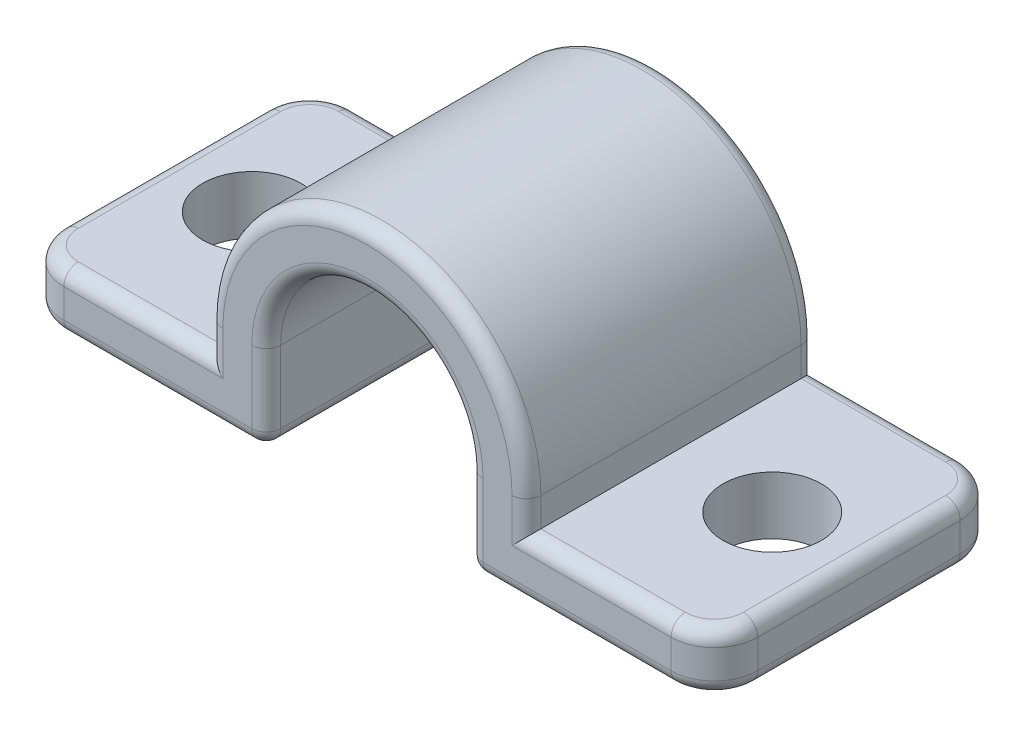
from build123d import *

# Parameters (mm, degrees)
BOSS_EXTRUDE1_DEPTH  = 10
M3_CLEARANCE_HOLE1_D = 3.4
FILLET1_R            = 1.5
FILLET2_R            = 0.5


with BuildPart() as part:
    # Sketch1 → Boss-Extrude1 (new body)
    with BuildSketch(Plane.XY):
        with BuildLine():
            ThreePointArc((-5.5, 0), (-5.477033779, -0.502096593), (-5.408326913, -1))
            Line((-5.408326913, -1), (-3.5, -1))
            Line((-3.5, -1), (-3.5, 0))
            ThreePointArc((-3.5, 0), (0, 3.5), (3.5, 0))
            Line((3.5, 0), (3.5, -1))
            Line((3.5, -1), (5.408326913, -1))
            ThreePointArc((5.408326913, -1), (5.477033779, -0.502096593), (5.5, 0))
            ThreePointArc((5.5, 0), (0, 5.5), (-5.5, 0))
        make_face()
        with BuildLine():
            Line((5.5, -1), (5.5, 0))
            ThreePointArc((5.5, 0), (5.477033779, -0.502096593), (5.408326913, -1))
            Line((5.408326913, -1), (5.5, -1))
        make_face()
        with BuildLine():
            Line((-5.5, 0), (-5.5, -1))
            Line((-5.5, -1), (-5.408326913, -1))
            ThreePointArc((-5.408326913, -1), (-5.477033779, -0.502096593), (-5.5, 0))
        make_face()
        with BuildLine():
            Line((-5.5, -1), (-12, -1))
            Line((-12, -1), (-12, -3))
            Line((-12, -3), (-4.609772229, -3))
            ThreePointArc((-4.609772229, -3), (-5.107893656, -2.039466204), (-5.408326913, -1))
            Line((-5.408326913, -1), (-5.5, -1))
        make_face()
        with BuildLine():
            Line((-3.5, -1), (-5.408326913, -1))
            ThreePointArc((-5.408326913, -1), (-5.107893656, -2.039466204), (-4.609772229, -3))
            Line((-4.609772229, -3), (-3.5, -3))
            Line((-3.5, -3), (-3.5, -1))
        make_face()
        with BuildLine():
            Line((3.5, -3), (4.609772229, -3))
            ThreePointArc((4.609772229, -3), (5.107893656, -2.039466204), (5.408326913, -1))
            Line((5.408326913, -1), (3.5, -1))
            Line((3.5, -1), (3.5, -3))
        make_face()
        with BuildLine():
            ThreePointArc((5.408326913, -1), (5.107893656, -2.039466204), (4.609772229, -3))
            Line((4.609772229, -3), (12, -3))
            Line((12, -3), (12, -1))
            Line((12, -1), (5.5, -1))
            Line((5.5, -1), (5.408326913, -1))
        make_face()
    extrude(amount=BOSS_EXTRUDE1_DEPTH)

    # M3 Clearance Hole1 (through all)
    with Locations(Plane(origin=(0, -1, 0), x_dir=(1, 0, 0), z_dir=(0, 1, 0))):
        with Locations((9, -5), (-9, -5)):
            Hole(M3_CLEARANCE_HOLE1_D / 2)

    # Fillet1
    fillet1_edges = [part.edges().sort_by_distance(p)[0] for p in [
        (12, -2, 0),
        (-12, -2, 0),
        (-12, -2, 10),
        (12, -2, 10),
    ]]
    fillet(fillet1_edges, radius=FILLET1_R)

    # Fillet2
    fillet2_edges = [part.edges().sort_by_distance(p)[0] for p in [
        (5.5, -0.5, 10),
        (7, -3, 0),
        (0, 5.5, 10),
        (3.5, -1.5, 0),
        (0, 3.5, 0),
        (-3.5, -1.5, 0),
        (-5.5, -0.5, 0),
        (0, 5.5, 0),
        (5.5, -0.5, 0),
        (-5.5, -0.5, 10),
        (8, -1, 0),
        (3.5, -3, 5),
        (-3.5, -3, 5),
        (-3.5, -1.5, 10),
        (0, 3.5, 10),
        (8, -1, 10),
        (3.5, -1.5, 10),
        (12, -1, 5),
        (12, -3, 5),
        (11.560660172, -3, 0.439339828),
        (11.560660172, -3, 9.560660172),
        (7, -3, 10),
        (-8, -1, 10),
        (-7, -3, 10),
        (11.560660172, -1, 0.439339828),
        (11.560660172, -1, 9.560660172),
        (-7, -3, 0),
        (-8, -1, 0),
        (-12, -3, 5),
        (-12, -1, 5),
        (-11.560660172, -3, 9.560660172),
        (-11.560660172, -3, 0.439339828),
        (-11.560660172, -1, 9.560660172),
        (-11.560660172, -1, 0.439339828),
    ]]
    fillet(fillet2_edges, radius=FILLET2_R)


solid = part.part
